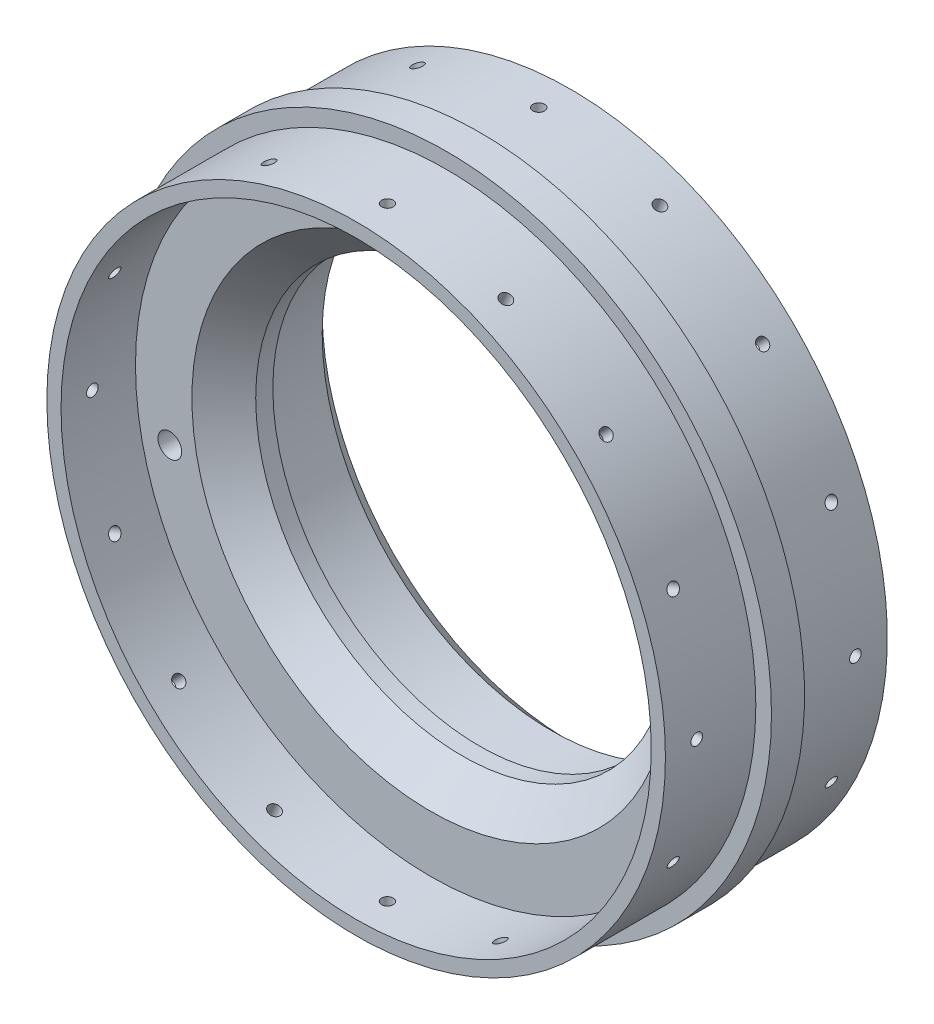
from build123d import *

# Parameters (mm, degrees)
SKETCH5_R                       = 69.85
EXTRUDE1_DEPTH                  = 46.101
SKETCH8_R                       = 44.45
EXTRUDE4_DEPTH                  = 110.010766445
SKETCH6_OUTSIDE_W               = 182.274
SKETCH6_OUTSIDE_H               = 182.274
SKETCH6_OUTSIDE_R               = 66.4845
EXTRUDE2_DEPTH                  = 19.431
SKETCH7_R                       = 63.4365
EXTRUDE3_DEPTH                  = 16.002
CHAMFER1_SIZE                   = 6.858
SKETCH9_OUTSIDE_W               = 182.274
SKETCH9_OUTSIDE_H               = 182.274
SKETCH9_OUTSIDE_R               = 68.0847
EXTRUDE5_DEPTH                  = 19.558
SKETCH10_R                      = 65.0367
SKETCH10_R_2                    = 53.7845
EXTRUDE6_DEPTH                  = 9.525
SKETCH11_R                      = 49.3395
EXTRUDE7_DEPTH                  = 19.558
CHAMFER2_SIZE                   = 4.064
CIRPATTERN1_COUNT               = 16
F_21_0_159_DIAMETER_HOLE1_D     = 4.0386
F_21_0_159_DIAMETER_HOLE1_DEPTH = 12.7
F_21_0_159_DIAMETER_HOLE1_TIP   = 1.213317848
F_1_4_20_TAPPED_HOLE1_D         = 5.1054
CIRPATTERN2_COUNT               = 2


with BuildPart() as part:
    # Sketch5 → Extrude1 (new body)
    with BuildSketch(Plane.XY):
        Circle(SKETCH5_R)
    extrude(amount=EXTRUDE1_DEPTH)

    # Sketch8 → Extrude4 (cut, through all)
    with BuildSketch(Plane.XY.offset(46.101)):
        Circle(SKETCH8_R)
    extrude(amount=-EXTRUDE4_DEPTH, mode=Mode.SUBTRACT)

    # Sketch6 outside → Extrude2 (cut)
    with BuildSketch(Plane.XY.offset(46.101)):
        Rectangle(SKETCH6_OUTSIDE_W, SKETCH6_OUTSIDE_H)
        Circle(SKETCH6_OUTSIDE_R, mode=Mode.SUBTRACT)
    extrude(amount=-EXTRUDE2_DEPTH, mode=Mode.SUBTRACT)

    # Sketch7 → Extrude3 (cut)
    with BuildSketch(Plane.XY.offset(46.101)):
        Circle(SKETCH7_R)
    extrude(amount=-EXTRUDE3_DEPTH, mode=Mode.SUBTRACT)

    # Chamfer1
    chamfer1_edges = [part.edges().sort_by_distance(p)[0] for p in [
        (-44.45, 0, 30.099),
    ]]
    chamfer(chamfer1_edges, length=CHAMFER1_SIZE)

    # Sketch9 outside → Extrude5 (cut)
    with BuildSketch(Plane(origin=(0, 0, 0), x_dir=(-1, 0, 0), z_dir=(0, 0, -1))):
        Rectangle(SKETCH9_OUTSIDE_W, SKETCH9_OUTSIDE_H)
        Circle(SKETCH9_OUTSIDE_R, mode=Mode.SUBTRACT)
    extrude(amount=-EXTRUDE5_DEPTH, mode=Mode.SUBTRACT)

    # Sketch10 → Extrude6 (cut)
    with BuildSketch(Plane(origin=(0, 0, 0), x_dir=(-1, 0, 0), z_dir=(0, 0, -1))):
        Circle(SKETCH10_R)
        Circle(SKETCH10_R_2, mode=Mode.SUBTRACT)
    extrude(amount=-EXTRUDE6_DEPTH, mode=Mode.SUBTRACT)

    # Sketch11 → Extrude7 (cut)
    with BuildSketch(Plane(origin=(0, 0, 0), x_dir=(-1, 0, 0), z_dir=(0, 0, -1))):
        Circle(SKETCH11_R)
    extrude(amount=-EXTRUDE7_DEPTH, mode=Mode.SUBTRACT)

    # Chamfer2
    chamfer2_edges = [part.edges().sort_by_distance(p)[0] for p in [
        (49.3395, 0, 0),
    ]]
    chamfer(chamfer2_edges, length=CHAMFER2_SIZE)

    # Sketch19 → M3x0.5 Tapped Hole2 (revolve, cut)
    with BuildSketch(Plane(origin=(0, 68.0847, 6.858), x_dir=(0, 0, 1), z_dir=(1, 0, 0))):
        Polygon((0, 0), (0, 9.387075774), (1.25, 8.636), (1.25, 0), align=None)
    m3x0_5_tapped_hole2 = revolve(axis=Axis((0, 74.4347, 6.858), (0, -1, 0)), mode=Mode.SUBTRACT)

    # Sketch25 → M3x0.5 Tapped Hole1 (revolve, cut)
    with BuildSketch(Plane(origin=(0, 66.4845, 39.37), x_dir=(0, 0, 1), z_dir=(1, 0, 0))):
        Polygon((0, 0), (0, 9.387075774), (1.25, 8.636), (1.25, 0), align=None)
    m3x0_5_tapped_hole1 = revolve(axis=Axis((0, 72.8345, 39.37), (0, -1, 0)), mode=Mode.SUBTRACT)

    # CirPattern1: M3x0.5 Tapped Hole2, M3x0.5 Tapped Hole1 ×16 about axis
    cirpattern1_axis = Axis((0, 0, 19.558), (0, 0, -1))
    add([m3x0_5_tapped_hole2.rotate(cirpattern1_axis, i * 360 / CIRPATTERN1_COUNT) for i in range(1, CIRPATTERN1_COUNT)], mode=Mode.SUBTRACT)
    add([m3x0_5_tapped_hole1.rotate(cirpattern1_axis, i * 360 / CIRPATTERN1_COUNT) for i in range(1, CIRPATTERN1_COUNT)], mode=Mode.SUBTRACT)

    # #21 (0.159) Diameter Hole1
    with Locations(Plane(origin=(13.627058993, -68.507851836, 23.114), x_dir=(0.9807852804032304, 0.19509032201612872, 0), z_dir=(0.1950903220161287, -0.9807852804032303, 0))):
        with Locations((0, 0)):
            Hole(F_21_0_159_DIAMETER_HOLE1_D / 2, depth=F_21_0_159_DIAMETER_HOLE1_DEPTH)
            with Locations((0, 0, -(F_21_0_159_DIAMETER_HOLE1_DEPTH + F_21_0_159_DIAMETER_HOLE1_TIP / 2))):  # 118° drill point
                Cone(0, F_21_0_159_DIAMETER_HOLE1_D / 2, F_21_0_159_DIAMETER_HOLE1_TIP, mode=Mode.SUBTRACT)

    # 1/4-20 Tapped Hole1 (through all)
    with Locations(Plane(origin=(56.051878775, 11.149411903, 30.099), x_dir=(1, 0, 0), z_dir=(0, 0, 1))):
        with Locations((0, 0)):
            f_1_4_20_tapped_hole1 = Hole(F_1_4_20_TAPPED_HOLE1_D / 2)

    # CirPattern2: 1/4-20 Tapped Hole1 ×2 about axis
    cirpattern2_axis = Axis((0, 0, 0), (0, 0, 1))
    for i in range(1, CIRPATTERN2_COUNT):
        add(f_1_4_20_tapped_hole1.rotate(cirpattern2_axis, i * 360 / CIRPATTERN2_COUNT), mode=Mode.SUBTRACT)


solid = part.part
